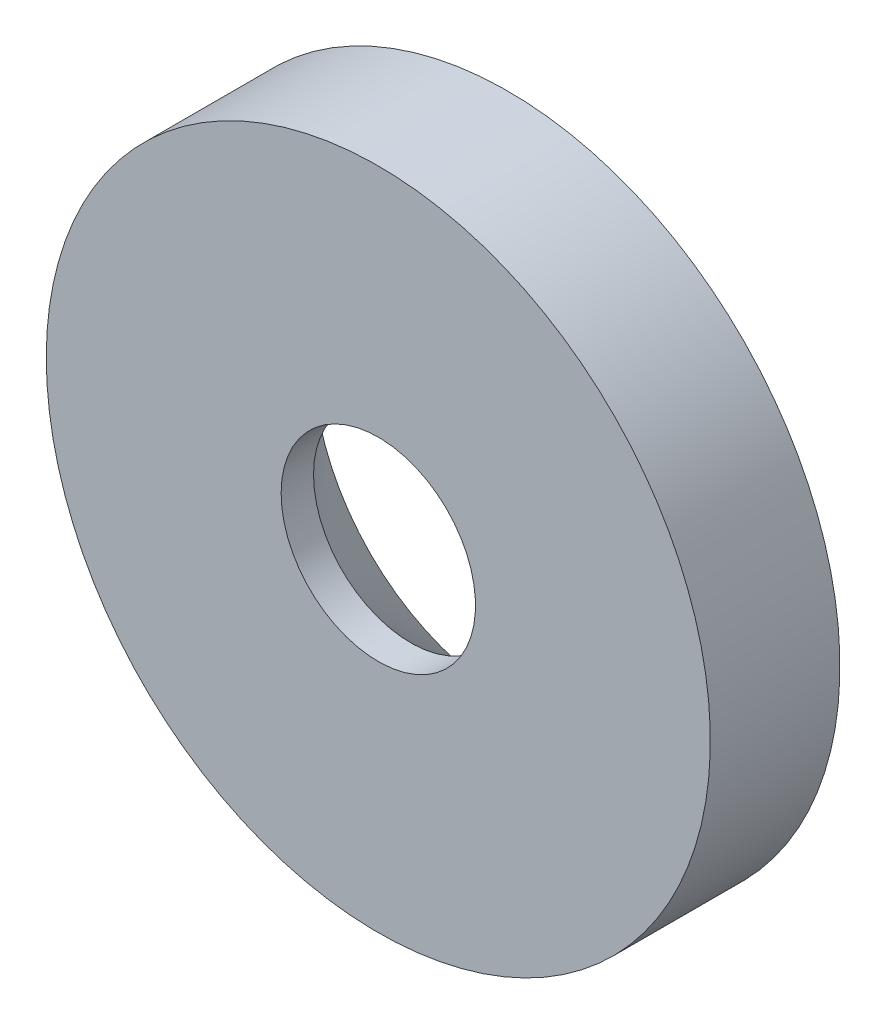
from build123d import *


with BuildPart() as part:
    # Sketch1 → Revolve1 (revolve)
    with BuildSketch(Plane(origin=(0, 0, 0), x_dir=(1, 0, 0), z_dir=(0, 1, 0)), mode=Mode.PRIVATE) as revolve1_sk:
        Polygon((6, 0), (20.5, 0), (20.5, 8), (12, 8), (6, 2), align=None)
    revolve(revolve1_sk.sketch.rotate(Axis((0, 0, -17.257142857), (0, 0, 1)), 180), axis=Axis((0, 0, -17.257142857), (0, 0, 1)))


solid = part.part
